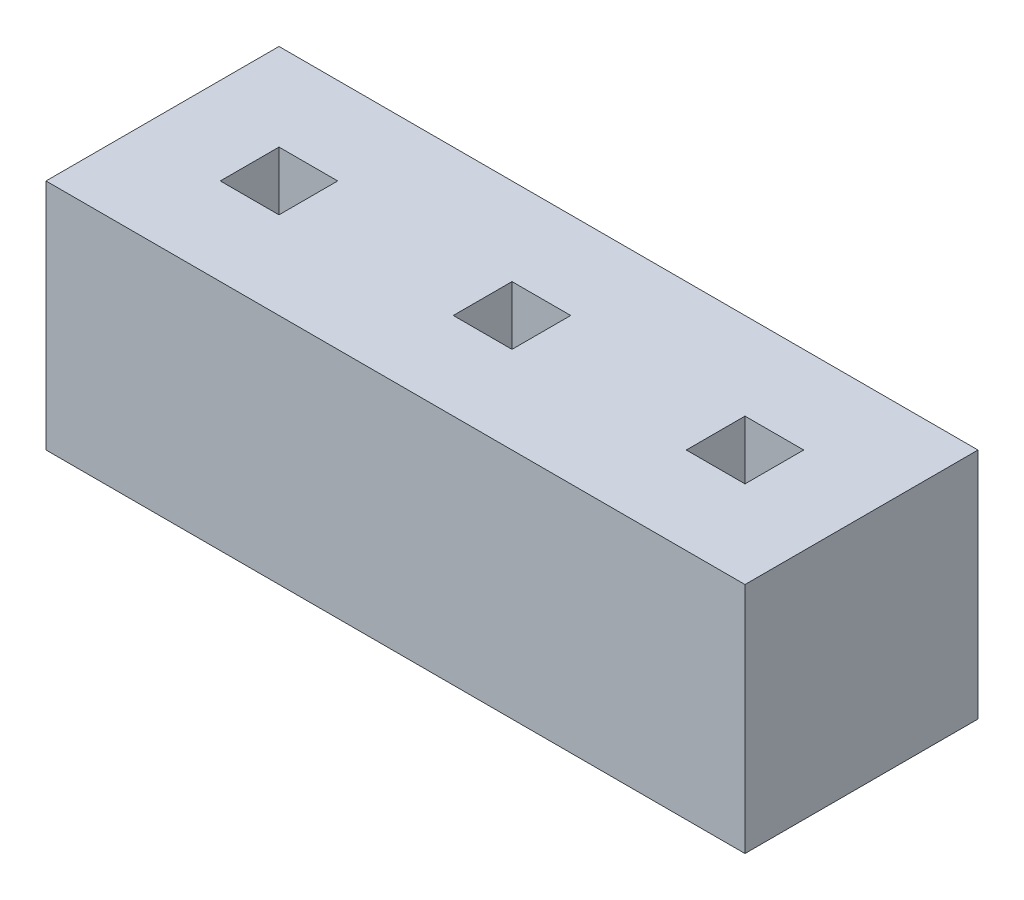
from build123d import *

# Parameters (mm, degrees)
SKETCH2_W           = 7.62
SKETCH2_H           = 2.54
BOSS_EXTRUDE1_DEPTH = 2.54
SKETCH3_W           = 0.64
SKETCH3_H           = 0.64
CUT_EXTRUDE1_DEPTH  = 5.751904881


with BuildPart() as part:
    # Sketch2 → Boss-Extrude1 (new body)
    with BuildSketch(Plane(origin=(0, 0, 0), x_dir=(1, 0, 0), z_dir=(0, 1, 0))):
        Rectangle(SKETCH2_W, SKETCH2_H)
    extrude(amount=BOSS_EXTRUDE1_DEPTH)

    # Sketch3 → Cut-Extrude1 (cut, through all)
    with BuildSketch(Plane(origin=(0, 2.54, 0), x_dir=(1, 0, 0), z_dir=(0, 1, 0))):
        Rectangle(SKETCH3_W, SKETCH3_H)
        with Locations((-2.54, 0)):
            Rectangle(SKETCH3_W, SKETCH3_H)
        with Locations((2.54, 0)):
            Rectangle(SKETCH3_W, SKETCH3_H)
    extrude(amount=-CUT_EXTRUDE1_DEPTH, mode=Mode.SUBTRACT)


solid = part.part
